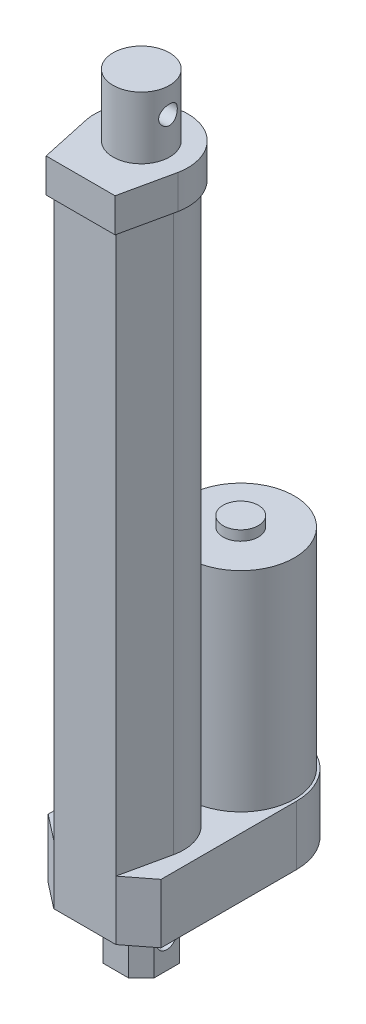
from build123d import *

# Parameters (mm, degrees)
ESTRUSIONE_ESTRUSIONE1_DEPTH = 21
ESTRUSIONE_ESTRUSIONE2_DEPTH = 19
FORO_PER_VITE_M6_5_1_D       = 7.1
FORO_PER_VITE_M6_5_1_DEPTH   = 80
FORO_PER_VITE_M6_5_1_TIP     = 2.133055198
SCHIZZO5_R                   = 19
ESTRUSIONE_ESTRUSIONE3_DEPTH = 74
SCHIZZO7_R                   = 6.25
ESTRUSIONE_ESTRUSIONE4_DEPTH = 3.5
ESTRUSIONE_ESTRUSIONE5_DEPTH = 198
ESTRUSIONE_ESTRUSIONE6_DEPTH = 12
SCHIZZO10_R                  = 10
ESTRUSIONE_ESTRUSIONE7_DEPTH = 22
FORO_PER_VITE_M6_1_D         = 6.6
FORO_PER_VITE_M6_1_DEPTH     = 80
FORO_PER_VITE_M6_1_TIP       = 1.982840043


with BuildPart() as part:
    # Schizzo1 → Estrusione-Estrusione1 (new body)
    with BuildSketch(Plane(origin=(0, 0, 0), x_dir=(1, 0, 0), z_dir=(0, 1, 0))):
        with BuildLine():
            Line((-20, 7), (-11, 0))
            Line((-11, 0), (11, 0))
            Line((11, 0), (20, 7))
            Line((20, 7), (20, 55))
            ThreePointArc((20, 55), (0, 75), (-20, 55))
            Line((-20, 55), (-20, 7))
        make_face()
    extrude(amount=ESTRUSIONE_ESTRUSIONE1_DEPTH)

    # Schizzo1<3> → Estrusione-Estrusione2 (add)
    with BuildSketch(Plane(origin=(0, 0, 0), x_dir=(1, 0, 0), z_dir=(0, 1, 0))):
        Polygon((-4.5, 11), (4.5, 11), (9, 15.5), (9, 24.5), (4.5, 29), (-4.5, 29), (-9, 24.5), (-9, 15.5), align=None)
    extrude(amount=-ESTRUSIONE_ESTRUSIONE2_DEPTH)

    # Foro per Vite M6.5-1
    with Locations(Plane(origin=(9, 0, 0), x_dir=(0, 0, -1), z_dir=(1, 0, 0))):
        with Locations((20, -9)):
            Hole(FORO_PER_VITE_M6_5_1_D / 2, depth=FORO_PER_VITE_M6_5_1_DEPTH)
            with Locations((0, 0, -(FORO_PER_VITE_M6_5_1_DEPTH + FORO_PER_VITE_M6_5_1_TIP / 2))):  # 118° drill point
                Cone(0, FORO_PER_VITE_M6_5_1_D / 2, FORO_PER_VITE_M6_5_1_TIP, mode=Mode.SUBTRACT)

    # Schizzo5 → Estrusione-Estrusione3 (add)
    with BuildSketch(Plane(origin=(0, 21, 0), x_dir=(1, 0, 0), z_dir=(0, 1, 0))):
        with Locations((0, 55.2)):
            Circle(SCHIZZO5_R)
    extrude(amount=ESTRUSIONE_ESTRUSIONE3_DEPTH)

    # Schizzo7 → Estrusione-Estrusione4 (add)
    with BuildSketch(Plane(origin=(0, 95, 0), x_dir=(1, 0, 0), z_dir=(0, 1, 0))):
        with Locations((0, 55.2)):
            Circle(SCHIZZO7_R)
    extrude(amount=ESTRUSIONE_ESTRUSIONE4_DEPTH)

    # Schizzo8 → Estrusione-Estrusione5 (add)
    with BuildSketch(Plane(origin=(0, 21, 0), x_dir=(1, 0, 0), z_dir=(0, 1, 0))):
        with BuildLine():
            Line((-11, 0), (11, 0))
            Line((11, 0), (14.657188407, 16.811453624))
            ThreePointArc((14.657188407, 16.811453624), (0, 35), (-14.657188407, 16.811453624))
            Line((-14.657188407, 16.811453624), (-11, 0))
        make_face()
    extrude(amount=ESTRUSIONE_ESTRUSIONE5_DEPTH)

    # Schizzo9 → Estrusione-Estrusione6 (add)
    with BuildSketch(Plane(origin=(0, 219, 0), x_dir=(1, 0, 0), z_dir=(0, 1, 0))):
        with BuildLine():
            Line((-12.208770737, -1.5), (12.208770737, -1.5))
            Line((12.208770737, -1.5), (16.192271356, 16.811453624))
            ThreePointArc((16.192271356, 16.811453624), (0, 36.503226341), (-16.192271356, 16.811453624))
            Line((-16.192271356, 16.811453624), (-12.208770737, -1.5))
        make_face()
    extrude(amount=ESTRUSIONE_ESTRUSIONE6_DEPTH)

    # Schizzo10 → Estrusione-Estrusione7 (add)
    with BuildSketch(Plane(origin=(0, 231, 0), x_dir=(1, 0, 0), z_dir=(0, 1, 0))):
        with Locations((0, 20)):
            Circle(SCHIZZO10_R)
    extrude(amount=ESTRUSIONE_ESTRUSIONE7_DEPTH)

    # Foro per Vite M6-1
    with Locations(Plane(origin=(10, 244, -20), x_dir=(0, 0, 1), z_dir=(1, 0, 0))):
        with Locations((0, 0)):
            Hole(FORO_PER_VITE_M6_1_D / 2, depth=FORO_PER_VITE_M6_1_DEPTH)
            with Locations((0, 0, -(FORO_PER_VITE_M6_1_DEPTH + FORO_PER_VITE_M6_1_TIP / 2))):  # 118° drill point
                Cone(0, FORO_PER_VITE_M6_1_D / 2, FORO_PER_VITE_M6_1_TIP, mode=Mode.SUBTRACT)


solid = part.part
